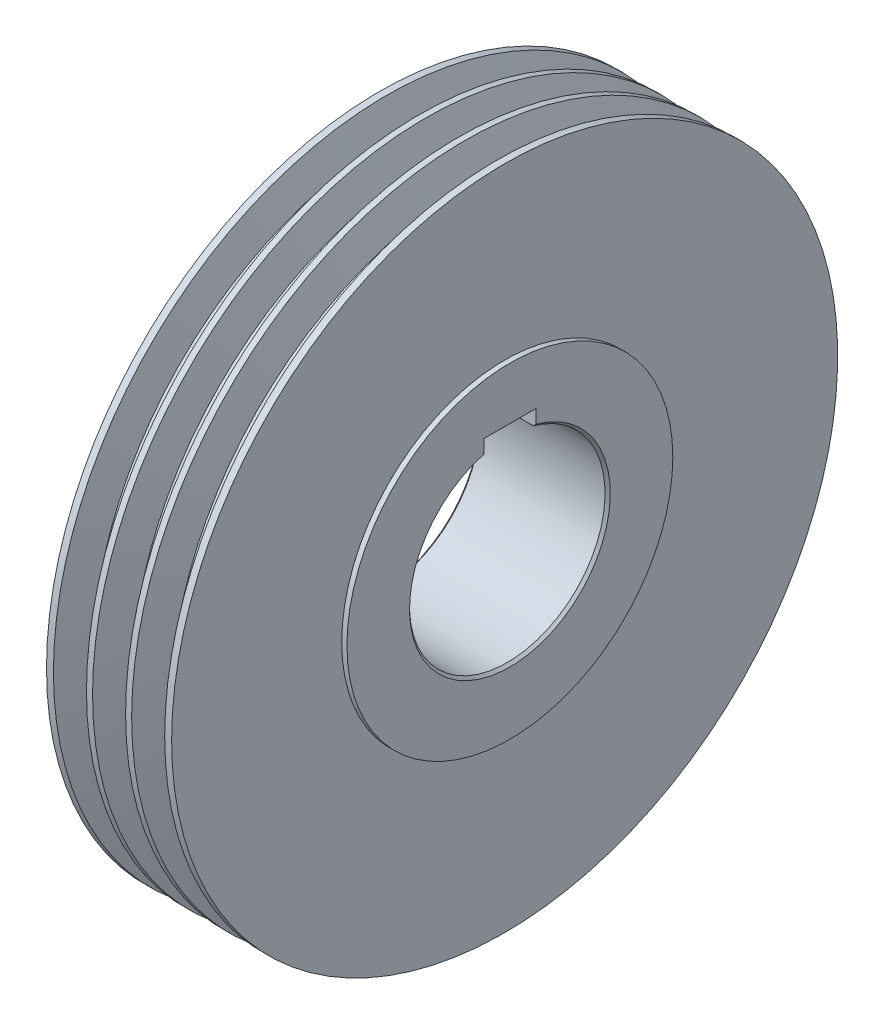
from build123d import *

# Parameters (mm, degrees)
PATTERN_LINEAR_1_COUNT = 3
PATTERN_LINEAR_1_PITCH = 15
CHAMFER_1_SIZE         = 1
SKETCH_4_W             = 20
SKETCH_4_H             = 6.257919263
CUT_EXTRUDE_1_DEPTH    = 188.456995068


with BuildPart() as part:
    # 草图1 → 旋转1 (revolve)
    with BuildSketch(Plane.XY, mode=Mode.PRIVATE) as revolve_1_sk:
        Polygon((0, 37.5), (0, 127.75), (48, 127.75), (48, 62.5), (50, 62.5), (50, 37.5), align=None)
    revolve(revolve_1_sk.sketch.rotate(Axis((0, 0, 0), (1, 0, 0)), 90), axis=Axis((0, 0, 0), (1, 0, 0)))

    # 草图2 → 切除-旋转1 (revolve, cut)
    with BuildSketch(Plane.XY, mode=Mode.PRIVATE) as cut_revolve_1_sk:
        Polygon((11.840143071, 116.3), (15.340759374, 127.75), (2.659240626, 127.75), (6.159856929, 116.3), align=None)
    cut_revolve_1 = revolve(cut_revolve_1_sk.sketch.rotate(Axis((0, 0, 0), (1, 0, 0)), 90), axis=Axis((0, 0, 0), (1, 0, 0)), mode=Mode.SUBTRACT)

    # 阵列(线性)1: 切除-旋转1 ×3
    with Locations(*[(i * PATTERN_LINEAR_1_PITCH, 0, 0) for i in range(1, PATTERN_LINEAR_1_COUNT)]):
        add(cut_revolve_1, mode=Mode.SUBTRACT)

    # 倒角1
    chamfer_1_edges = [part.edges().sort_by_distance(p)[0] for p in [
        (50, 0, -37.5),
        (0, 0, -37.5),
    ]]
    chamfer(chamfer_1_edges, length=CHAMFER_1_SIZE)

    # 草图4 → 切除-拉伸1 (cut, through all)
    with BuildSketch(Plane.ZY):
        with Locations((0, 39.271040369)):
            Rectangle(SKETCH_4_W, SKETCH_4_H)
    extrude(amount=-CUT_EXTRUDE_1_DEPTH, mode=Mode.SUBTRACT)


solid = part.part
